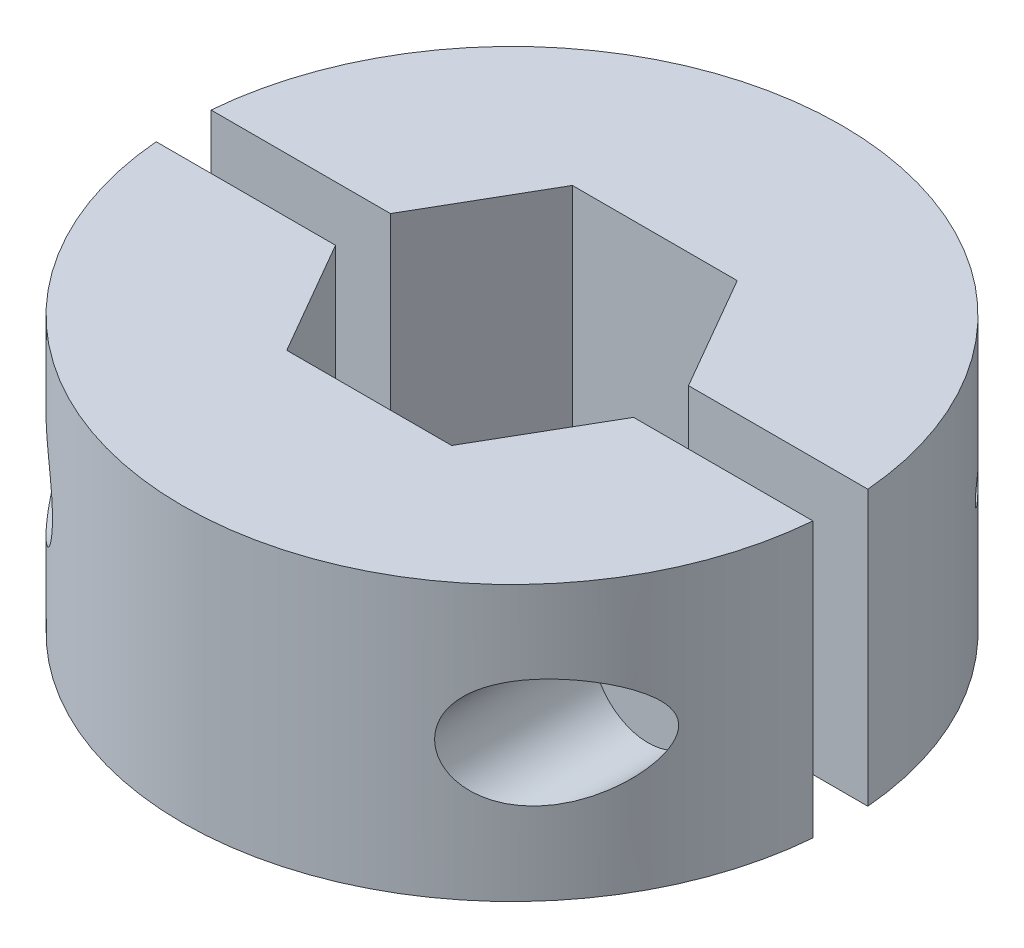
from build123d import *

# Parameters (mm, degrees)
SKETCH1_R           = 15.24
BOSS_EXTRUDE1_DEPTH = 12.7
CUT_EXTRUDE1_DEPTH  = 12.7
CUT_EXTRUDE2_DEPTH  = 12.7
SKETCH4_R           = 2.54
CUT_EXTRUDE3_DEPTH  = 10.16
SKETCH5_R           = 0.508
CUT_EXTRUDE4_DEPTH  = 29.369651136


with BuildPart() as part:
    # Sketch1 → Boss-Extrude1 (new body)
    with BuildSketch(Plane(origin=(0, 0, 0), x_dir=(1, 0, 0), z_dir=(0, 1, 0))):
        with Locations(Location((0, 0, 0), (0, 0, 270))):
            Circle(SKETCH1_R)
    extrude(amount=BOSS_EXTRUDE1_DEPTH)

    # Sketch2 → Cut-Extrude1 (cut)
    with BuildSketch(Plane(origin=(0, 12.7, 0), x_dir=(1, 0, 0), z_dir=(0, 1, 0))):
        Polygon((7.625642355, 0), (3.812821178, 6.604), (-3.812821178, 6.604), (-7.625642355, 0), (-3.812821178, -6.604), (3.812821178, -6.604), align=None)
    extrude(amount=-CUT_EXTRUDE1_DEPTH, mode=Mode.SUBTRACT)

    # Sketch3 → Cut-Extrude2 (cut)
    with BuildSketch(Plane(origin=(0, 12.7, 0), x_dir=(1, 0, 0), z_dir=(0, 1, 0))):
        Polygon((-15.24, 0), (-15.24, -1.27), (15.24, -1.27), (15.24, 0), (15.24, 1.27), (-15.24, 1.27), align=None)
    extrude(amount=-CUT_EXTRUDE2_DEPTH, mode=Mode.SUBTRACT)


with BuildPart() as cut_extrude2_piece_1:
    # of the separate pieces the step leaves, piece 1, a body of its own (cut_extrude2_pieces)
    add(part.part.solids().sort_by_distance((-15.186991144, 0, 1.27))[0])

    # Sketch4 → Cut-Extrude3 (cut)
    with BuildSketch(Plane.XY.offset(15.24)):
        with Locations((-11.376991144, 6.35)):
            Circle(SKETCH4_R)
        with Locations((11.376991144, 6.35)):
            Circle(SKETCH4_R)
    extrude(amount=-CUT_EXTRUDE3_DEPTH, mode=Mode.SUBTRACT)


with BuildPart() as cut_extrude2_piece_2:
    # of the separate pieces the step leaves, piece 2, a body of its own (cut_extrude2_pieces)
    add(part.part.solids().sort_by_distance((15.186991144, 0, -1.27))[0])


with BuildPart() as cut_extrude4_tool:
    # Sketch5 → Cut-Extrude4 (new, through all)
    with BuildSketch(Plane.XY.offset(5.08)):
        with Locations((-11.376991144, 6.35)):
            Circle(SKETCH5_R)
        with Locations((11.376991144, 6.35)):
            Circle(SKETCH5_R)
    extrude(amount=-CUT_EXTRUDE4_DEPTH)


with BuildPart() as cut_extrude2_piece_1_1:
    add(cut_extrude2_piece_1.part)

    # Cut-Extrude4: cut by cut_extrude4_tool
    add(cut_extrude4_tool.part, mode=Mode.SUBTRACT)


with BuildPart() as cut_extrude2_piece_2_1:
    add(cut_extrude2_piece_2.part)

    # Cut-Extrude4: cut by cut_extrude4_tool
    add(cut_extrude4_tool.part, mode=Mode.SUBTRACT)


solid = Compound([cut_extrude2_piece_1_1.part, cut_extrude2_piece_2_1.part])
